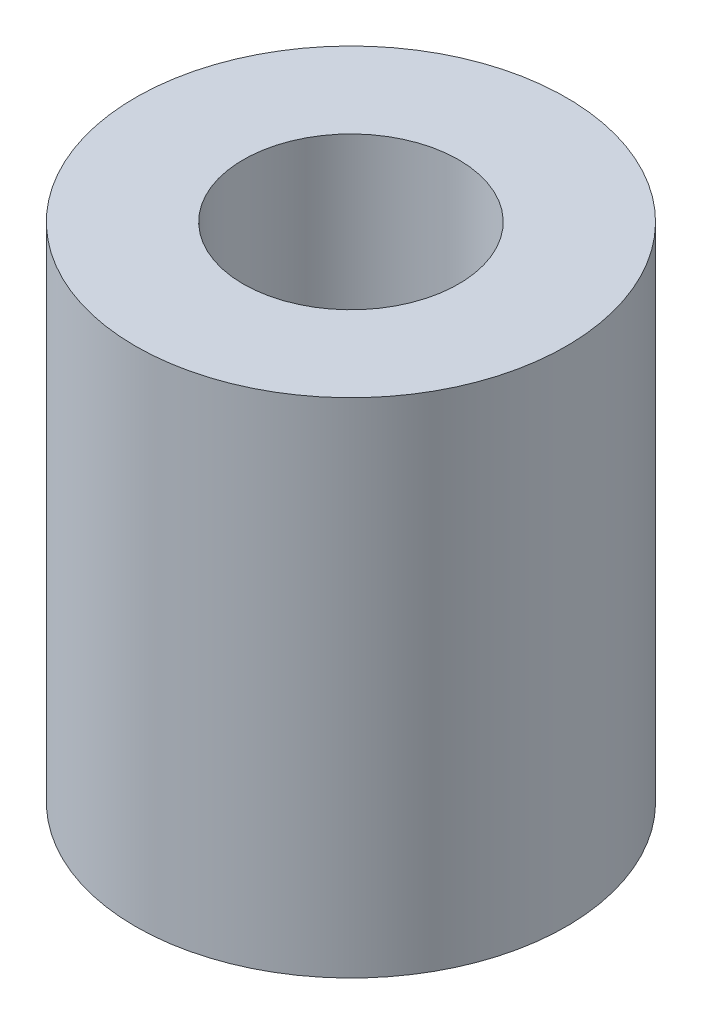
from build123d import *

# Parameters (mm, degrees)
SKETCH_1_R      = 3
SKETCH_1_R_2    = 1.5
EXTRUDE_1_DEPTH = 7


with BuildPart() as part:
    # 草图1 → 凸台-拉伸1 (new body)
    with BuildSketch(Plane(origin=(0, 0, 0), x_dir=(1, 0, 0), z_dir=(0, 1, 0))):
        with Locations(Location((0, 0, 0), (0, 0, 270))):
            Circle(SKETCH_1_R)
        with Locations(Location((0, 0, 0), (0, 0, 270))):
            Circle(SKETCH_1_R_2, mode=Mode.SUBTRACT)
    extrude(amount=EXTRUDE_1_DEPTH)


solid = part.part
